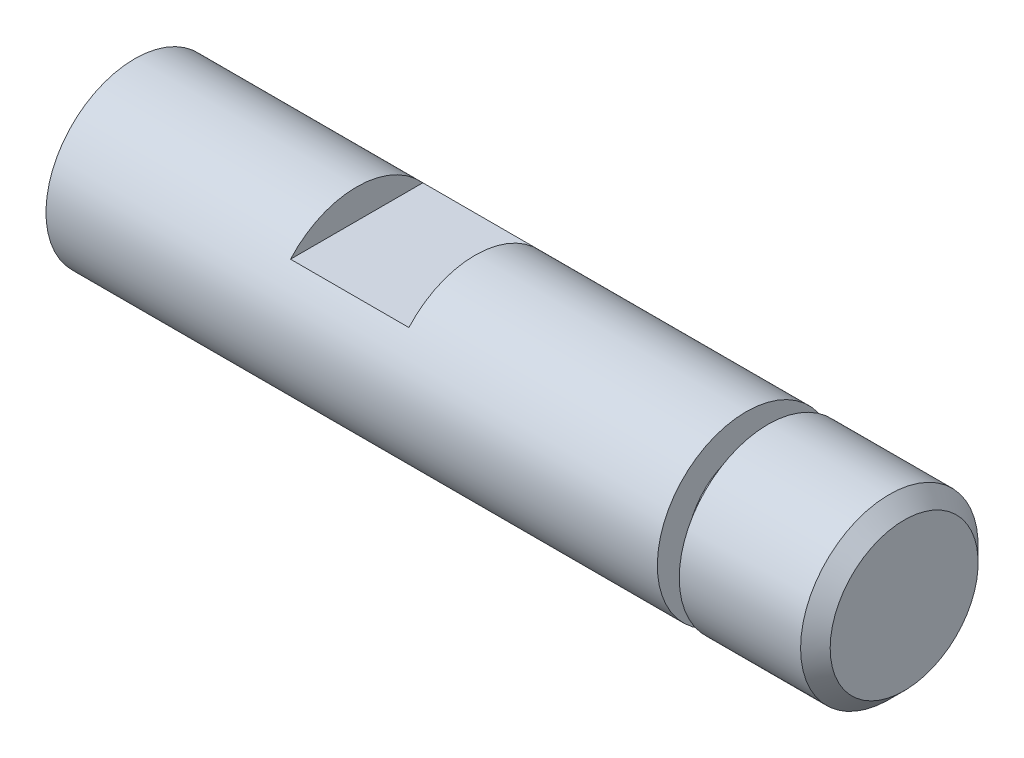
from build123d import *

# Parameters (mm, degrees)
ESQUISSE1_W                  = 52
ESQUISSE1_H                  = 3
CHANFREIN1_SIZE              = 0.5
ENL_V_MAT_EXTRU_1_DEPTH      = 27.343879745
ENL_V_MAT_EXTRU_1_DEPTH_BACK = 27.343879745
ESQUISSE2_W                  = 4
ESQUISSE2_H                  = 2
ESQUISSE3_W                  = 0.74
ESQUISSE3_H                  = 1
BOSS_EXTRU_1_START           = 15
ESQUISSE4_R                  = 3
BOSS_EXTRU_1_DEPTH           = 15
ENL_V_MAT_EXTRU_2_DEPTH      = 42.218927691
ENL_V_MAT_EXTRU_2_DEPTH_BACK = 42.218927691
ESQUISSE5_W                  = 12
ESQUISSE5_H                  = 1
ENL_V_MAT_EXTRU_3_DEPTH      = 42.218927691
ENL_V_MAT_EXTRU_3_DEPTH_BACK = 42.218927691
ESQUISSE6_W                  = 50.211323454
ESQUISSE6_H                  = 20.21753951


with BuildPart() as part:
    # Esquisse1 → Révolution1 (revolve)
    with BuildSketch(Plane.XY, mode=Mode.PRIVATE) as r_volution1_sk:
        with Locations((0, 1.5)):
            Rectangle(ESQUISSE1_W, ESQUISSE1_H)
    revolve(r_volution1_sk.sketch.rotate(Axis((0, 0, 0), (1, 0, 0)), 90), axis=Axis((0, 0, 0), (1, 0, 0)))

    # Chanfrein1
    chanfrein1_edges = [part.edges().sort_by_distance(p)[0] for p in [
        (26, 0, -3),
    ]]
    chamfer(chanfrein1_edges, length=CHANFREIN1_SIZE)

    # Esquisse2 → Enlèv. mat.-Extru.1 (cut, two sides: drawn at the far end of the back side and taken through both)
    with BuildSketch(Plane.XY.offset(-ENL_V_MAT_EXTRU_1_DEPTH_BACK)):
        with Locations((9.5, 3)):
            Rectangle(ESQUISSE2_W, ESQUISSE2_H)
    extrude(amount=ENL_V_MAT_EXTRU_1_DEPTH + ENL_V_MAT_EXTRU_1_DEPTH_BACK, mode=Mode.SUBTRACT)

    # Esquisse3 → Enlèvement de matière-Révolution1 (revolve, cut)
    with BuildSketch(Plane.XY):
        with Locations((-21.03, 2.5)):
            Rectangle(ESQUISSE3_W, ESQUISSE3_H)
        with Locations((21.03, 2.5)):
            Rectangle(ESQUISSE3_W, ESQUISSE3_H)
    revolve(axis=Axis((0, 0, 0), (-1, 0, 0)), mode=Mode.SUBTRACT)

    # Esquisse4 → Boss.-Extru.1 (add)
    with BuildSketch(Plane.ZY.offset(26).offset(BOSS_EXTRU_1_START)):
        with Locations(Location((0, 0, 0), (0, 0, 90))):
            Circle(ESQUISSE4_R)
    extrude(amount=-BOSS_EXTRU_1_DEPTH)

    # Esquisse5 → Enlèv. mat.-Extru.2 (cut, two sides: drawn at the far end of the back side and taken through both)
    with BuildSketch(Plane.XY.offset(-ENL_V_MAT_EXTRU_2_DEPTH_BACK)):
        with Locations((-35, 2.5)):
            Rectangle(ESQUISSE5_W, ESQUISSE5_H)
    extrude(amount=ENL_V_MAT_EXTRU_2_DEPTH + ENL_V_MAT_EXTRU_2_DEPTH_BACK, mode=Mode.SUBTRACT)

    # Esquisse6 → Enlèv. mat.-Extru.3 (cut, two sides: drawn at the far end of the back side and taken through both)
    with BuildSketch(Plane.XY.offset(-ENL_V_MAT_EXTRU_3_DEPTH_BACK)):
        with Locations((-25.105661727, 1.097333559)):
            Rectangle(ESQUISSE6_W, ESQUISSE6_H)
    extrude(amount=ENL_V_MAT_EXTRU_3_DEPTH + ENL_V_MAT_EXTRU_3_DEPTH_BACK, mode=Mode.SUBTRACT)


solid = part.part
